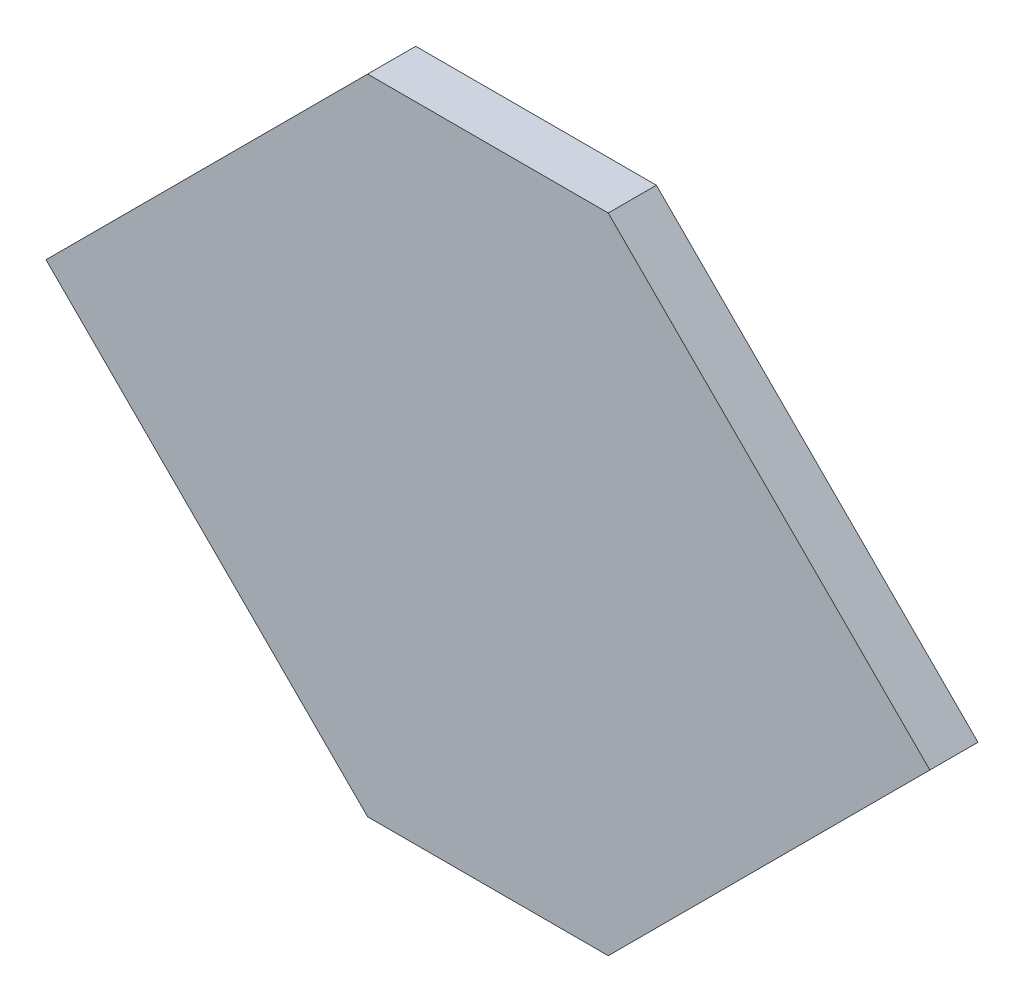
from build123d import *

# Parameters (mm, degrees)
BOSS_EXTRU_2_DEPTH = 10


with BuildPart() as part:
    # Esquisse2 → Boss.-Extru.2 (new body)
    with BuildSketch(Plane.XY):
        Polygon((-25, 66.82), (25, 66.82), (91.82, 0), (25, -66.82), (-25, -66.82), (-91.82, 0), align=None)
    extrude(amount=BOSS_EXTRU_2_DEPTH)


solid = part.part
